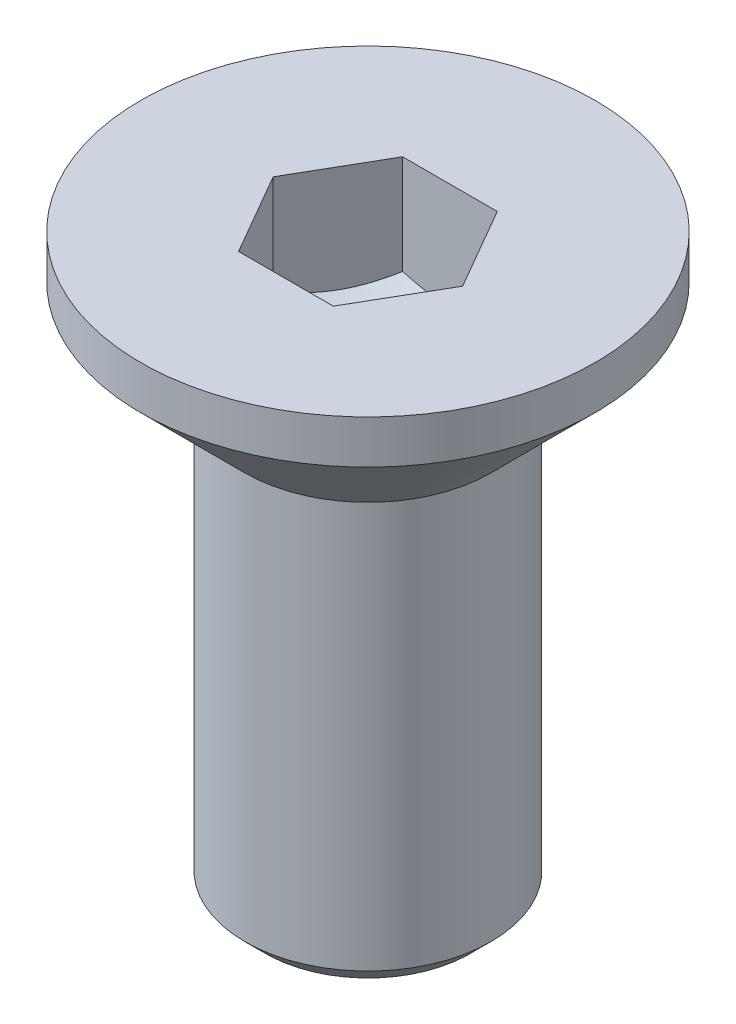
from build123d import *

# Parameters (mm, degrees)
CUT_EXTRUDE_1_REACH = 10.022


with BuildPart() as part:
    # 草图1 → 旋转1 (revolve)
    with BuildSketch(Plane.XY, mode=Mode.PRIVATE) as revolve_1_sk:
        Polygon((1.5, -1.8), (1.5, -6.75), (1.25, -7), (0, -7), (0, -1.877350269), (1, -1.3), (1, 0), (2.77, 0), (2.77, -0.53), align=None)
    revolve(revolve_1_sk.sketch.rotate(Axis((0, 0, 0), (0, 1, 0)), 90), axis=Axis((0, 0, 0), (0, 1, 0)))

    # 切除-拉伸1: up to this cone (the profile starts inside it)
    cut_extrude_1_end = Plane(origin=(0, 0, 0), z_dir=(0, 1, 0)).offset(-1.877349269) * Cone(1.732e-06, 27.108355455, 15.651015319, align=(Align.CENTER, Align.CENTER, Align.MIN), mode=Mode.PRIVATE)
    # 草图2 → 切除-拉伸1 (cut, up to the surface)
    with BuildSketch(Plane(origin=(0, 0, 0), x_dir=(1, 0, 0), z_dir=(0, 1, 0)), mode=Mode.PRIVATE) as cut_extrude_1_sk1:
        Polygon((1.154700538, 0), (0.577350269, 1), (-0.577350269, 1), (-1.154700538, 0), (-0.577350269, -1), (0.577350269, -1), align=None)
    cut_extrude_1_tool1 = extrude(cut_extrude_1_sk1.sketch, amount=-CUT_EXTRUDE_1_REACH, mode=Mode.PRIVATE) & cut_extrude_1_end
    add(cut_extrude_1_tool1.solids().sort_by_distance((0, 0, 0))[0], mode=Mode.SUBTRACT)


solid = part.part
